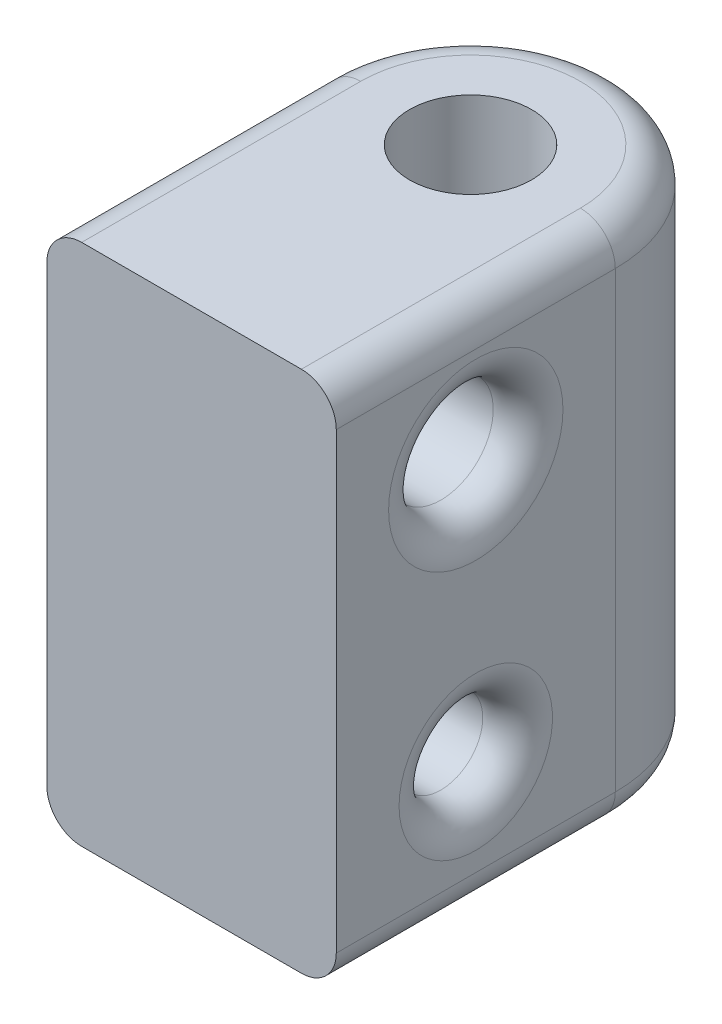
from build123d import *

# Parameters (mm, degrees)
SKETCH2_R               = 1.75
BOSS_EXTRUDE1_DEPTH     = 7.5
CUT_EXTRUDE1_DEPTH      = 14.752817893
CUT_EXTRUDE1_DEPTH_BACK = 14.752817893
SKETCH3_R               = 1.2
SKETCH3_R_2             = 1.5
FILLET1_R               = 1
FILLET2_R               = 1


with BuildPart() as part:
    # Sketch2 → Boss-Extrude1 (new, symmetric)
    with BuildSketch(Plane(origin=(0, 0, 0), x_dir=(1, 0, 0), z_dir=(0, 1, 0))):
        with BuildLine():
            Line((-4.15, 0), (-4.15, -8))
            Line((-4.15, -8), (4.15, -8))
            Line((4.15, -8), (4.15, 0))
            ThreePointArc((4.15, 0), (0, 4.15), (-4.15, 0))
        make_face()
        with Locations(Location((0, 0, 0), (0, 0, 270))):
            Circle(SKETCH2_R, mode=Mode.SUBTRACT)
    extrude(amount=BOSS_EXTRUDE1_DEPTH, both=True)

    # Sketch3 → Cut-Extrude1 (cut, two sides: drawn at the far end of the back side and taken through both)
    with BuildSketch(Plane.ZY.offset(4.15).offset(-CUT_EXTRUDE1_DEPTH_BACK)):
        with Locations((4, -3.75)):
            Circle(SKETCH3_R)
        with Locations((4, 3.75)):
            Circle(SKETCH3_R_2)
    extrude(amount=CUT_EXTRUDE1_DEPTH + CUT_EXTRUDE1_DEPTH_BACK, mode=Mode.SUBTRACT)

    # Fillet1
    fillet1_edges = [part.edges().sort_by_distance(p)[0] for p in [
        (4.15, -3.75, 2.8),
        (-4.15, -3.75, 2.8),
        (4.15, 3.75, 2.5),
        (-4.15, 3.75, 2.5),
    ]]
    fillet(fillet1_edges, radius=FILLET1_R)

    # Fillet2
    fillet2_edges = [part.edges().sort_by_distance(p)[0] for p in [
        (4.15, 7.5, 4),
        (0, 7.5, -4.15),
        (4.15, -7.5, 4),
        (-4.15, -7.5, 4),
        (0, -7.5, -4.15),
        (-4.15, 7.5, 4),
    ]]
    fillet(fillet2_edges, radius=FILLET2_R)


solid = part.part
